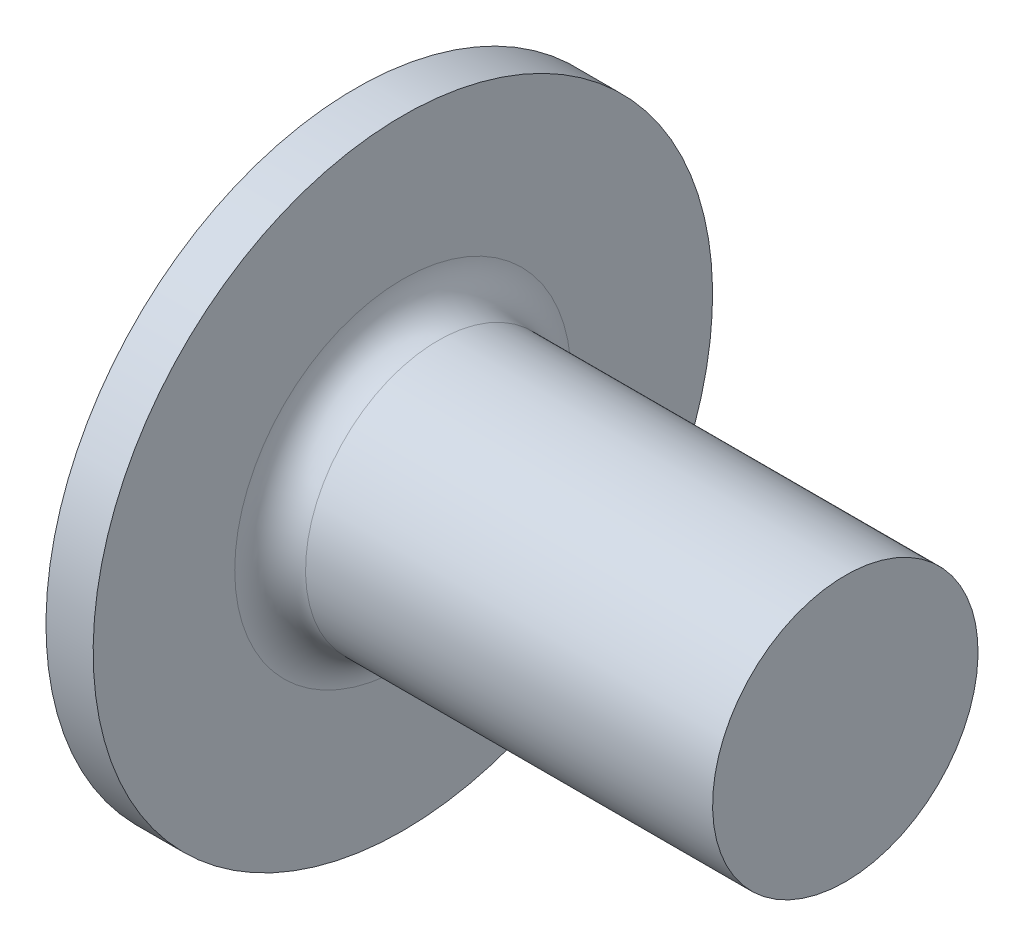
from build123d import *

# Parameters (mm, degrees)
CUT_EXTRUDE1_DEPTH = 0.75
FILLET1_R          = 0.4


with BuildPart() as part:
    # Sketch1 → Revolve1 (revolve)
    with BuildSketch(Plane.XY):
        Polygon((0, 1.5), (5, 1.5), (5, 0), (-0.8, 0), (-0.8, 3.038119785), (-0.533333333, 3.5), (0, 3.5), align=None)
    revolve(axis=Axis((-0.8, 0, 0), (1, 0, 0)))

    # Sketch2 → Cut-Extrude1 (cut)
    with BuildSketch(Plane(origin=(-0.8, 0, 0), x_dir=(0, 0, -1), z_dir=(1, 0, 0))):
        with BuildLine():
            ThreePointArc((0.16930818, 0.744268952), (0, 0.875), (-0.16930818, 0.744268952))
            ThreePointArc((-0.16930818, 0.744268952), (-0.3175, 0.549926131), (-0.55990173, 0.518759661))
            ThreePointArc((-0.55990173, 0.518759661), (-0.757772228, 0.4375), (-0.72920991, 0.225509291))
            ThreePointArc((-0.72920991, 0.225509291), (-0.635, 0), (-0.72920991, -0.225509291))
            ThreePointArc((-0.72920991, -0.225509291), (-0.757772228, -0.4375), (-0.55990173, -0.518759661))
            ThreePointArc((-0.55990173, -0.518759661), (-0.3175, -0.549926131), (-0.16930818, -0.744268952))
            ThreePointArc((-0.16930818, -0.744268952), (0, -0.875), (0.16930818, -0.744268952))
            ThreePointArc((0.16930818, -0.744268952), (0.3175, -0.549926131), (0.55990173, -0.518759661))
            ThreePointArc((0.55990173, -0.518759661), (0.757772228, -0.4375), (0.72920991, -0.225509291))
            ThreePointArc((0.72920991, -0.225509291), (0.635, 0), (0.72920991, 0.225509291))
            ThreePointArc((0.72920991, 0.225509291), (0.757772228, 0.4375), (0.55990173, 0.518759661))
            ThreePointArc((0.55990173, 0.518759661), (0.3175, 0.549926131), (0.16930818, 0.744268952))
        make_face()
    extrude(amount=CUT_EXTRUDE1_DEPTH, mode=Mode.SUBTRACT)

    # Fillet1
    fillet1_edges = [part.edges().sort_by_distance(p)[0] for p in [
        (0, -1.5, 0),
    ]]
    fillet(fillet1_edges, radius=FILLET1_R)


solid = part.part
